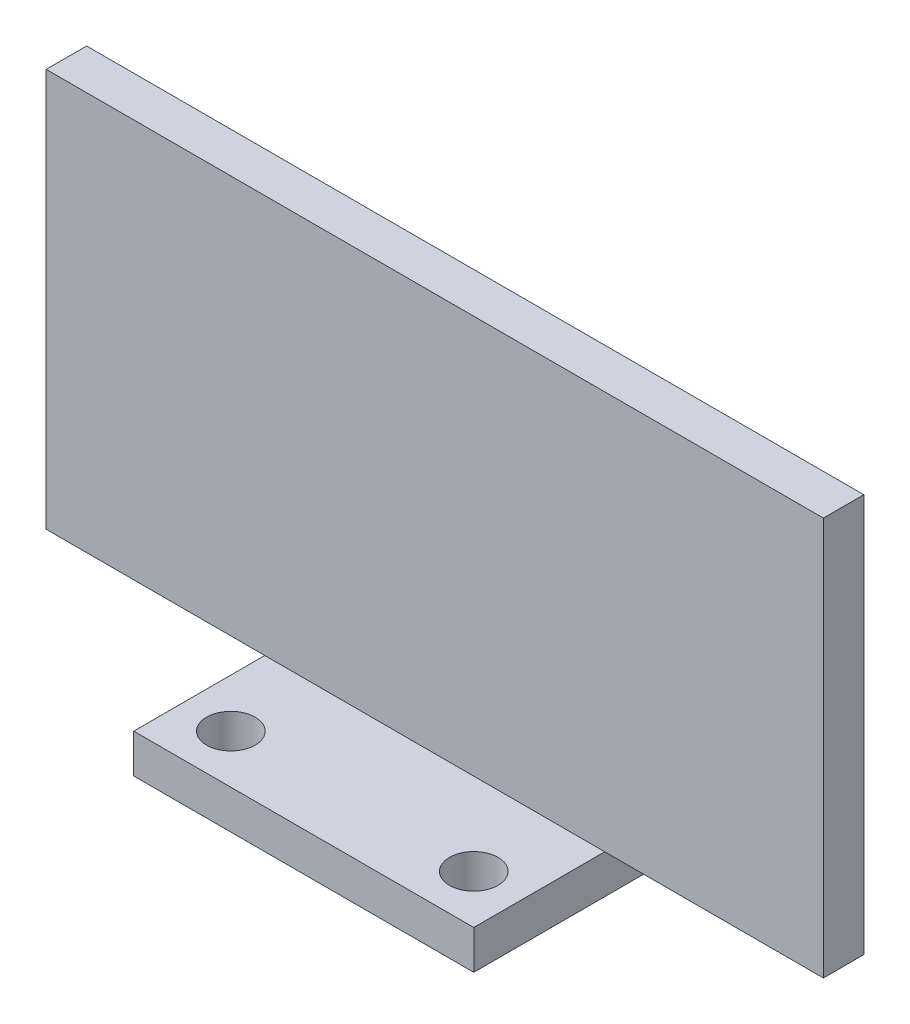
from build123d import *

# Parameters (mm, degrees)
SKETCH1_W           = 35
SKETCH1_H           = 30
SKETCH1_R           = 2.5
BOSS_EXTRUDE1_DEPTH = 4
SKETCH2_W           = 80
SKETCH2_H           = 4.163287005
BOSS_EXTRUDE2_DEPTH = 41


with BuildPart() as part:
    # Sketch1 → Boss-Extrude1 (new body)
    with BuildSketch(Plane(origin=(0, 0, 0), x_dir=(1, 0, 0), z_dir=(0, 1, 0))):
        with Locations((17.5, 15)):
            Rectangle(SKETCH1_W, SKETCH1_H)
        with Locations(Location((5, 25, 0), (0, 0, 270))):
            Circle(SKETCH1_R, mode=Mode.SUBTRACT)
        with Locations(Location((30, 25, 0), (0, 0, 270))):
            Circle(SKETCH1_R, mode=Mode.SUBTRACT)
        with Locations(Location((5, 5, 0), (0, 0, 270))):
            Circle(SKETCH1_R, mode=Mode.SUBTRACT)
        with Locations(Location((30, 5, 0), (0, 0, 270))):
            Circle(SKETCH1_R, mode=Mode.SUBTRACT)
    extrude(amount=BOSS_EXTRUDE1_DEPTH)

    # Sketch2 → Boss-Extrude2 (add)
    with BuildSketch(Plane(origin=(0, 4, 0), x_dir=(1, 0, 0), z_dir=(0, 1, 0))):
        with Locations((17.5, 15.569712959)):
            Rectangle(SKETCH2_W, SKETCH2_H)
    extrude(amount=BOSS_EXTRUDE2_DEPTH)


solid = part.part
